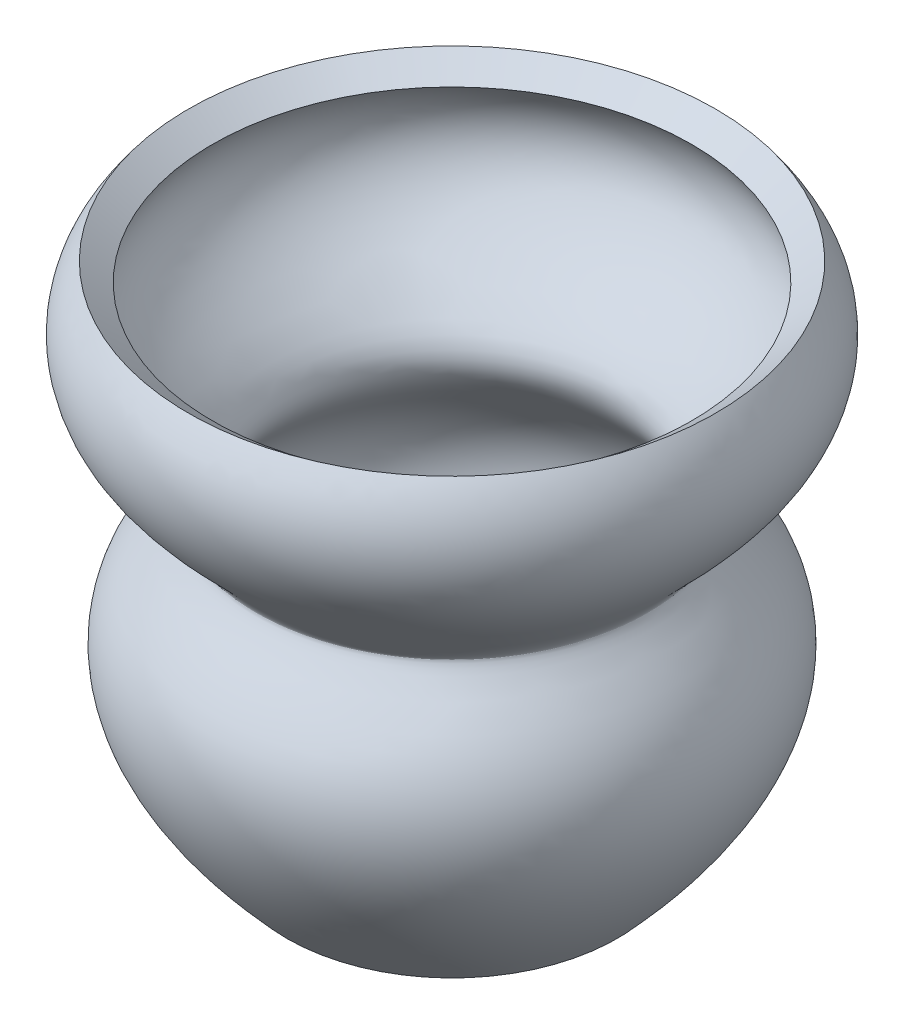
from build123d import *


with BuildPart() as part:
    # Sketch1 → Revolve2 (revolve)
    with BuildSketch(Plane.XY, mode=Mode.PRIVATE) as revolve2_sk:
        with BuildLine():
            Line((0, 0), (25, 0))
            add(Edge.make_bspline(
                [(25, 0), (54.122911021, 32.533569178), (2.76332705, 37.683942782), (48.962105471, 62.77065997), (39.478781423, 74.984524482)],
                knots=[0, 0, 0, 0, 0.623312733, 1, 1, 1, 1], degree=3))
            Line((39.478781423, 74.984524482), (43.428102908, 78.050932774))
            add(Edge.make_bspline(
                [(27.234838932, -5), (27.603742449, -4.587893255), (28.154151574, -3.97240097), (28.899815006, -3.141073257), (30.043769912, -1.847657931), (32.33785243, 0.854691764), (35.34792954, 4.807230278), (38.158021161, 9.225848272), (40.240214217, 13.385762461), (41.636915817, 17.332223321), (42.630012655, 22.344613875), (42.268111235, 28.11629612), (39.927327718, 33.697058401), (36.902327586, 37.872151791), (34.584447642, 40.518620708), (33.235297247, 42.19739796), (32.56295527, 43.190432103), (32.271856882, 43.824988532), (32.256617594, 44.001781731), (32.253224227, 43.936090927), (32.288453432, 44.13716806), (32.575247398, 44.63588584), (33.125631307, 45.406067461), (34.228315477, 46.682041352), (36.029919682, 48.530768454), (38.822582866, 51.329865077), (42.630808829, 55.401169882), (45.904890195, 60.494889829), (47.304615709, 65.552570402), (47.330180345, 69.065412917), (46.714553782, 71.913965093), (45.933968295, 74.025511589), (44.856671432, 76.068608047), (43.921878483, 77.414984034), (43.428102908, 78.050932774)],
                knots=[-0.010634175, -0.010634175, -0.010634175, -0.010634175, -0.002738595, 0.001209195, 0.005156984, 0.020948143, 0.052530461, 0.084112779, 0.115695097, 0.147277415, 0.178859733, 0.242024369, 0.305189005, 0.368353641, 0.431518277, 0.463100595, 0.494682913, 0.526265231, 0.557847549, 0.589429867, 0.621012184, 0.636803343, 0.652594502, 0.68417682, 0.715759138, 0.747341456, 0.810506092, 0.873670728, 0.905253046, 0.936835364, 0.952626523, 0.968417682, 0.984208841, 1, 1, 1, 1], degree=3))
            Line((27.234838932, -5), (0, -5))
            Line((0, -5), (0, 0))
        make_face()
    revolve(revolve2_sk.sketch.rotate(Axis((0, 0, 0), (0, 1, 0)), 90), axis=Axis((0, 0, 0), (0, 1, 0)))


solid = part.part
